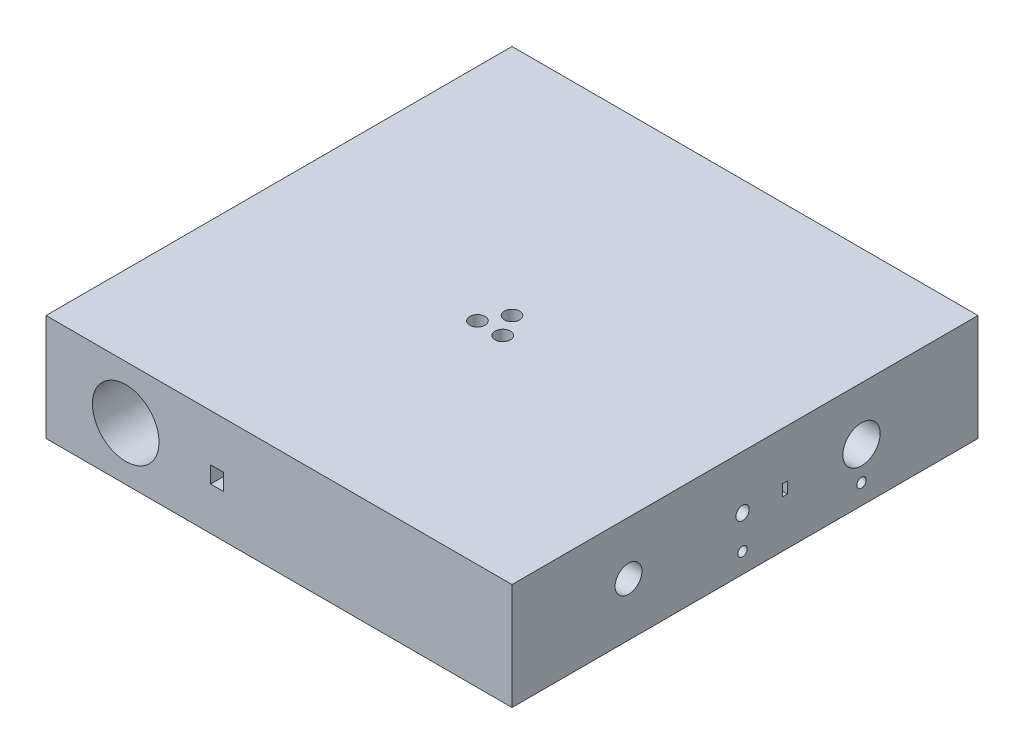
from build123d import *

# Parameters (mm, degrees)
SKETCH1_W               = 350
SKETCH1_H               = 350
BOSS_EXTRUDE1_DEPTH     = 80
CUT_EXTRUDE1_DEPTH      = 261.096136073
SKETCH2_4_R             = 5.75
CUT_EXTRUDE2_DEPTH      = 261.096136073
SKETCH2_5_R             = 5.75
CUT_EXTRUDE3_DEPTH      = 261.096136073
SKETCH3_W               = 3.7
SKETCH3_H               = 8.5
CUT_EXTRUDE4_DEPTH      = 400.405808671
SKETCH4_R               = 10.1
CUT_EXTRUDE5_DEPTH      = 400.405808671
CUT_EXTRUDE7_DEPTH      = 10
CUT_EXTRUDE7_DEPTH_BACK = 400.405808671
SKETCH6_R               = 3.555
SKETCH7_R               = 3.555
CUT_EXTRUDE8_DEPTH      = 400.405808778
SKETCH9_R               = 14
CUT_EXTRUDE10_DEPTH     = 400.405808778
SKETCH11_R              = 5.025
CUT_EXTRUDE12_DEPTH     = 400.405808778
SKETCH13_R              = 25
CUT_EXTRUDE14_DEPTH     = 400.405808735
SKETCH14_W              = 9.7
SKETCH14_H              = 12.5
CUT_EXTRUDE18_DEPTH     = 400.405808822


with BuildPart() as part:
    # Sketch1 → Boss-Extrude1 (new body)
    with BuildSketch(Plane(origin=(0, 0, 0), x_dir=(1, 0, 0), z_dir=(0, 1, 0))):
        Rectangle(SKETCH1_W, SKETCH1_H)
    extrude(amount=BOSS_EXTRUDE1_DEPTH)

    # Sketch2 → Cut-Extrude1 (cut, through all)
    with BuildSketch(Plane(origin=(0, 80, 0), x_dir=(1, 0, 0), z_dir=(0, 1, 0))):
        with BuildLine():
            ThreePointArc((0, 5.75), (-4.065863992, -4.065863992), (5.75, 0))
            ThreePointArc((5.75, 0), (4.065863992, 4.065863992), (0, 5.75))
        make_face()
    extrude(amount=-CUT_EXTRUDE1_DEPTH, mode=Mode.SUBTRACT)

    # Sketch2<4> → Cut-Extrude2 (cut, through all)
    with BuildSketch(Plane(origin=(0, 80, 0), x_dir=(1, 0, 0), z_dir=(0, 1, 0))):
        with Locations((9.5, -16.454482672)):
            Circle(SKETCH2_4_R)
    extrude(amount=-CUT_EXTRUDE2_DEPTH, mode=Mode.SUBTRACT)

    # Sketch2<5> → Cut-Extrude3 (cut, through all)
    with BuildSketch(Plane(origin=(0, 80, 0), x_dir=(1, 0, 0), z_dir=(0, 1, 0))):
        with Locations((-9.5, -16.454482672)):
            Circle(SKETCH2_5_R)
    extrude(amount=-CUT_EXTRUDE3_DEPTH, mode=Mode.SUBTRACT)

    # Sketch3 → Cut-Extrude4 (cut, through all)
    with BuildSketch(Plane.ZY.offset(175)):
        with Locations((-30, 39.681610839)):
            Rectangle(SKETCH3_W, SKETCH3_H)
    extrude(amount=-CUT_EXTRUDE4_DEPTH, mode=Mode.SUBTRACT)

    # Sketch4 → Cut-Extrude5 (cut, through all)
    with BuildSketch(Plane.ZY.offset(175)):
        with Locations((87.5, 40)):
            Circle(SKETCH4_R)
    extrude(amount=-CUT_EXTRUDE5_DEPTH, mode=Mode.SUBTRACT)

    # Sketch6 → Cut-Extrude7 (cut, two sides: drawn at the far end of the back side and taken through both)
    with BuildSketch(Plane.ZY.offset(175).offset(-CUT_EXTRUDE7_DEPTH_BACK)):
        with Locations((1.85, 15)):
            Circle(SKETCH6_R)
    extrude(amount=CUT_EXTRUDE7_DEPTH + CUT_EXTRUDE7_DEPTH_BACK, mode=Mode.SUBTRACT)

    # Sketch7 → Cut-Extrude8 (cut, through all)
    with BuildSketch(Plane.ZY.offset(175)):
        with Locations((-87.5, 15)):
            Circle(SKETCH7_R)
    extrude(amount=-CUT_EXTRUDE8_DEPTH, mode=Mode.SUBTRACT)

    # Sketch9 → Cut-Extrude10 (cut, through all)
    with BuildSketch(Plane.ZY.offset(175)):
        with Locations((-87.5, 40)):
            Circle(SKETCH9_R)
    extrude(amount=-CUT_EXTRUDE10_DEPTH, mode=Mode.SUBTRACT)

    # Sketch11 → Cut-Extrude12 (cut, through all)
    with BuildSketch(Plane.ZY.offset(175)):
        with Locations((1.85, 40)):
            Circle(SKETCH11_R)
    extrude(amount=-CUT_EXTRUDE12_DEPTH, mode=Mode.SUBTRACT)

    # Sketch13 → Cut-Extrude14 (cut, through all)
    with BuildSketch(Plane(origin=(0, 0, -175), x_dir=(-1, 0, 0), z_dir=(0, 0, -1))):
        with Locations((115.112005789, 40)):
            Circle(SKETCH13_R)
    extrude(amount=-CUT_EXTRUDE14_DEPTH, mode=Mode.SUBTRACT)

    # Sketch14 → Cut-Extrude18 (cut, through all)
    with BuildSketch(Plane(origin=(0, 0, -175), x_dir=(-1, 0, 0), z_dir=(0, 0, -1))):
        with Locations((46.47975887, 38.444138081)):
            Rectangle(SKETCH14_W, SKETCH14_H)
    extrude(amount=-CUT_EXTRUDE18_DEPTH, mode=Mode.SUBTRACT)


solid = part.part
